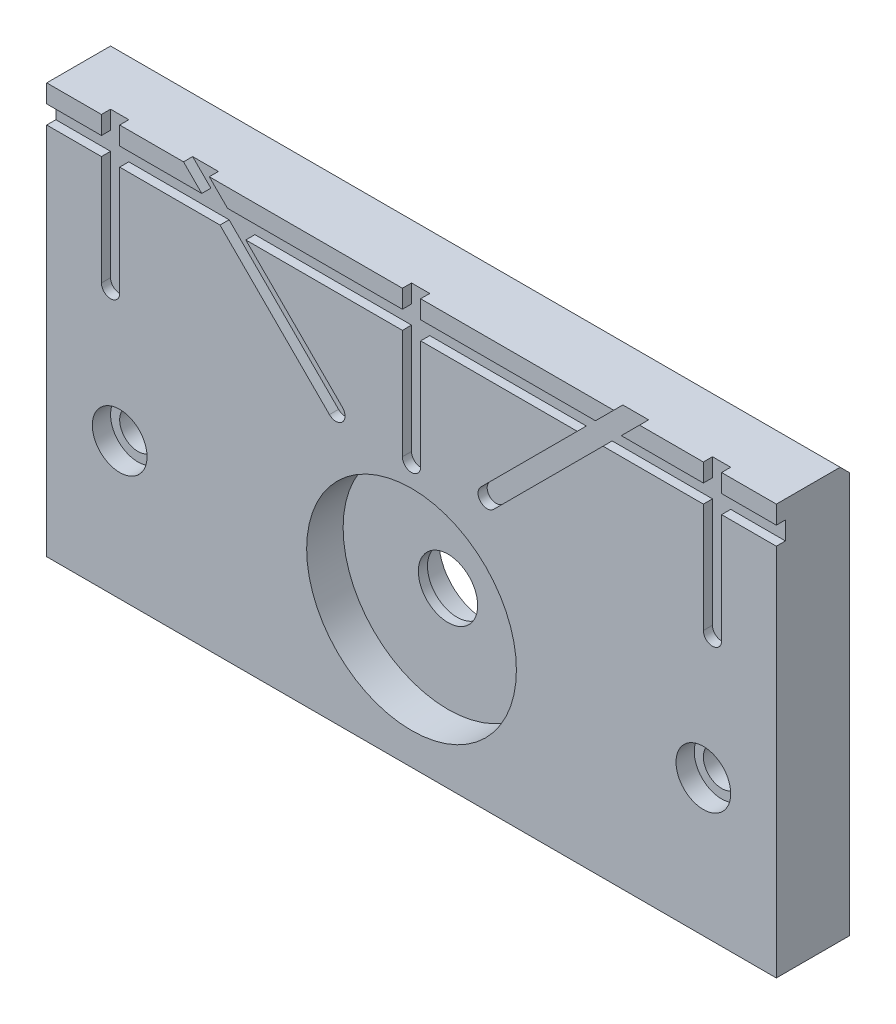
from build123d import *

# Parameters (mm, degrees)
SKETCH_1_W                     = 80
SKETCH_1_H                     = 60
EXTRUDE_1_DEPTH                = 8
HOLE_WIZARD_M3_5_1_D           = 4
HOLE_WIZARD_M3_5_1_CBORE_D     = 6
HOLE_WIZARD_M3_5_1_CBORE_DEPTH = 2
SKETCH_14_W                    = 80
SKETCH_14_H                    = 2
SKETCH_14_W_2                  = 2
SKETCH_14_H_2                  = 16
CUT_EXTRUDE_1_DEPTH            = 1
CUT_EXTRUDE_2_REACH            = 92.174
SKETCH_15_R                    = 3.25
SKETCH_17_R                    = 11.5
CUT_EXTRUDE_4_DEPTH            = 4
SKETCH_18_R                    = 5
CUT_EXTRUDE_5_DEPTH            = 3
CHAMFER_1_SIZE                 = 1.499999999
CHAMFER_1_SIZE2                = 1.500000001
CHAMFER_2_SIZE                 = 1
SKETCH_20_W                    = 80
SKETCH_20_H                    = 6
CUT_EXTRUDE_6_DEPTH            = 1
SKETCH_21_W                    = 80
SKETCH_21_H                    = 4
CUT_EXTRUDE_7_DEPTH            = 1
SKETCH_22_W                    = 80
SKETCH_22_H                    = 2
CUT_EXTRUDE_8_DEPTH            = 1
SKETCH_23_R                    = 1
CUT_EXTRUDE_9_DEPTH            = 1
CUT_EXTRUDE_10_REACH           = 92.174
SKETCH_24_W                    = 80
SKETCH_24_H                    = 15


with BuildPart() as part:
    # 草图1 → 凸台-拉伸1 (new body)
    with BuildSketch(Plane.XY.offset(8)):
        with Locations((40, 10.833333333)):
            Rectangle(SKETCH_1_W, SKETCH_1_H)
    extrude(amount=-EXTRUDE_1_DEPTH)

    # M3.5 六角头机械螺钉的柱形沉头孔1 (through all)
    with Locations(Plane.XY.offset(8)):
        with Locations((8, 10.833333333), (72, 10.833333333)):
            CounterBoreHole(HOLE_WIZARD_M3_5_1_D / 2, HOLE_WIZARD_M3_5_1_CBORE_D / 2, HOLE_WIZARD_M3_5_1_CBORE_DEPTH)

    # 草图14 → 切除-拉伸1 (cut)
    with BuildSketch(Plane.XY.offset(8)):
        with Locations((40, 37.833333333)):
            Rectangle(SKETCH_14_W, SKETCH_14_H)
        Polygon((15, 40.833333333), (31, 24.833333333), (32.414213562, 26.247546896), (16.414213562, 42.247546896), align=None)
        with Locations((7, 32.833333333)):
            Rectangle(SKETCH_14_W_2, SKETCH_14_H_2)
        with Locations((40, 32.833333333)):
            Rectangle(SKETCH_14_W_2, SKETCH_14_H_2)
        with Locations((73, 32.833333333)):
            Rectangle(SKETCH_14_W_2, SKETCH_14_H_2)
        Polygon((47.585786438, 26.247546896), (63.585786438, 42.247546896), (65, 40.833333333), (49, 24.833333333), align=None)
    extrude(amount=-CUT_EXTRUDE_1_DEPTH, mode=Mode.SUBTRACT)

    # 草图15 → 切除-拉伸2 (cut, up to next)
    with BuildSketch(Plane.XY.offset(8), mode=Mode.PRIVATE) as cut_extrude_2_sk1:
        with Locations((40, 10.833333333)):
            Circle(SKETCH_15_R)
    cut_extrude_2_tool1 = extrude(cut_extrude_2_sk1.sketch, amount=-CUT_EXTRUDE_2_REACH, mode=Mode.PRIVATE) & part.part
    add(cut_extrude_2_tool1.solids().sort_by_distance((40, 10.833333, 8))[0], mode=Mode.SUBTRACT)

    # 草图17 → 切除-拉伸4 (cut)
    with BuildSketch(Plane.XY.offset(8)):
        with Locations((40, 10.833333333)):
            Circle(SKETCH_17_R)
    extrude(amount=-CUT_EXTRUDE_4_DEPTH, mode=Mode.SUBTRACT)

    # 草图18 → 切除-拉伸5 (cut)
    with BuildSketch(Plane(origin=(0, 0, 0), x_dir=(-1, 0, 0), z_dir=(0, 0, -1))):
        with Locations((-40, 10.833333333)):
            Circle(SKETCH_18_R)
    extrude(amount=-CUT_EXTRUDE_5_DEPTH, mode=Mode.SUBTRACT)

    # 倒角1
    chamfer_1_edges = [part.edges().sort_by_distance(p)[0] for p in [
        (74, 10.833333333, 0),
        (10, 10.833333333, 0),
    ]]
    chamfer_1_side = [part.faces().sort_by_distance(p)[0] for p in [
        (79, 10.833333333, 0),
    ]]
    chamfer(chamfer_1_edges, length=CHAMFER_1_SIZE, length2=CHAMFER_1_SIZE2, reference=chamfer_1_side[0])

    # 倒角2
    chamfer_2_edges = [part.edges().sort_by_distance(p)[0] for p in [
        (40, 40.833333333, 0),
    ]]
    chamfer(chamfer_2_edges, length=CHAMFER_2_SIZE)

    # 草图20 → 切除-拉伸6 (cut)
    with BuildSketch(Plane.XY.offset(8)):
        with Locations((40, -16.166666667)):
            Rectangle(SKETCH_20_W, SKETCH_20_H)
    extrude(amount=-CUT_EXTRUDE_6_DEPTH, mode=Mode.SUBTRACT)

    # 草图21 → 切除-拉伸7 (cut)
    with BuildSketch(Plane.XY.offset(7)):
        with Locations((40, -17.166666667)):
            Rectangle(SKETCH_21_W, SKETCH_21_H)
    extrude(amount=-CUT_EXTRUDE_7_DEPTH, mode=Mode.SUBTRACT)

    # 草图22 → 切除-拉伸8 (cut)
    with BuildSketch(Plane.XY.offset(6)):
        with Locations((40, -18.166666667)):
            Rectangle(SKETCH_22_W, SKETCH_22_H)
    extrude(amount=-CUT_EXTRUDE_8_DEPTH, mode=Mode.SUBTRACT)

    # 草图23 → 切除-拉伸9 (cut)
    with BuildSketch(Plane.XY.offset(8)):
        with Locations((7, 24.833333333)):
            Circle(SKETCH_23_R)
        with Locations((31.707106781, 25.540440115)):
            Circle(SKETCH_23_R)
        with Locations((40, 24.833333333)):
            Circle(SKETCH_23_R)
        with Locations((48.292893219, 25.540440115)):
            Circle(SKETCH_23_R)
        with Locations((73, 24.833333333)):
            Circle(SKETCH_23_R)
    extrude(amount=-CUT_EXTRUDE_9_DEPTH, mode=Mode.SUBTRACT)

    # 草图24 → 切除-拉伸10 (cut, up to next)
    with BuildSketch(Plane.XY.offset(8), mode=Mode.PRIVATE) as cut_extrude_10_sk1:
        with Locations((40, -11.666666667)):
            Rectangle(SKETCH_24_W, SKETCH_24_H)
    cut_extrude_10_tool1 = extrude(cut_extrude_10_sk1.sketch, amount=-CUT_EXTRUDE_10_REACH, mode=Mode.PRIVATE) & part.part
    add(cut_extrude_10_tool1.solids().sort_by_distance((40, -11.666667, 8))[0], mode=Mode.SUBTRACT)


solid = part.part
